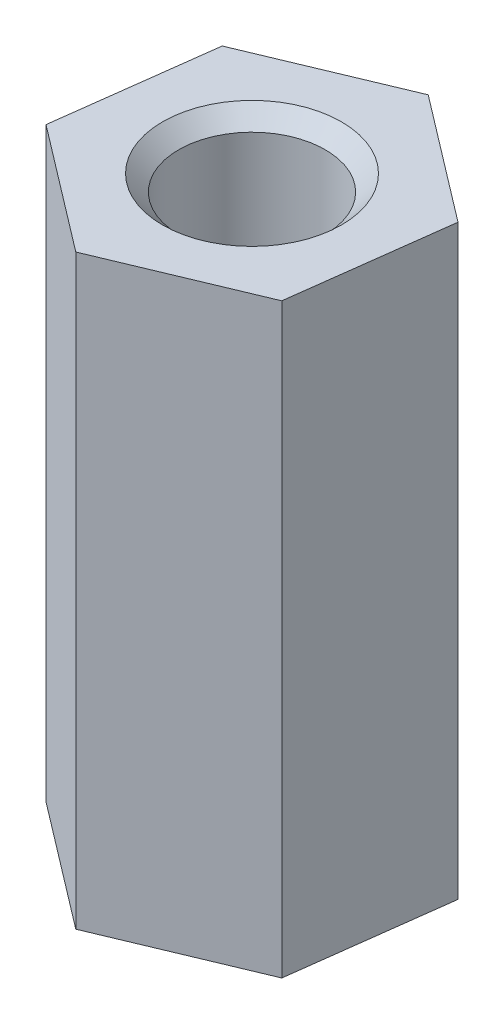
from build123d import *

# Parameters (mm, degrees)
EXTRUDE_1_DEPTH              = 10
HOLE_WIZARD_M3_1_D           = 2.5
HOLE_WIZARD_M3_1_CSINK_D     = 3.05
HOLE_WIZARD_M3_1_CSINK_ANGLE = 90


with BuildPart() as part:
    # 草图1 → 凸台-拉伸1 (new body)
    with BuildSketch(Plane(origin=(0, 0, 0), x_dir=(1, 0, 0), z_dir=(0, 1, 0))):
        Polygon((-2.476941254, -1.035500857), (-0.341700579, -2.662844478), (2.135240675, -1.627343621), (2.476941254, 1.035500857), (0.341700579, 2.662844478), (-2.135240675, 1.627343621), align=None)
    extrude(amount=EXTRUDE_1_DEPTH)

    # M3 螺纹孔1 (through all)
    with Locations(Plane(origin=(0, 10, 0), x_dir=(1, 0, 0), z_dir=(0, 1, 0))):
        with Locations((0, 0)):
            CounterSinkHole(HOLE_WIZARD_M3_1_D / 2, HOLE_WIZARD_M3_1_CSINK_D / 2, counter_sink_angle=HOLE_WIZARD_M3_1_CSINK_ANGLE)


solid = part.part
